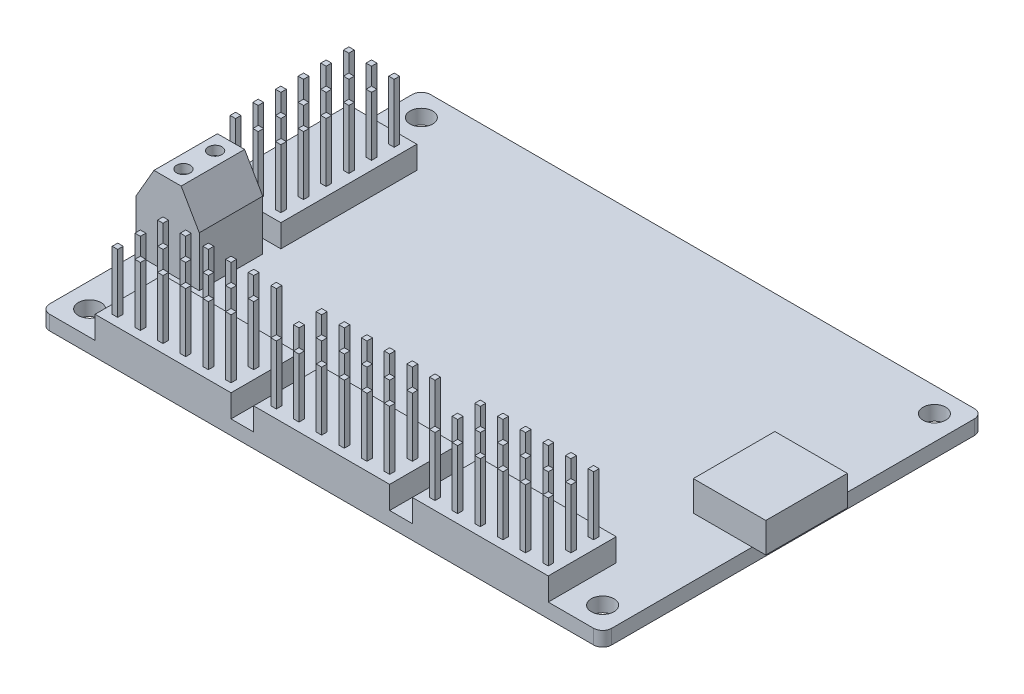
from build123d import *

# Parameters (mm, degrees)
SKETCH1_W                  = 62
SKETCH1_H                  = 42
SKETCH1_R                  = 1.25
BOSS_EXTRUDE1_DEPTH        = 1.6
FILLET1_R                  = 1
SKETCH2_W                  = 8
SKETCH2_H                  = 9
BOSS_EXTRUDE2_DEPTH        = 3.3
SKETCH3_W                  = 15
SKETCH3_H                  = 7.5
BOSS_EXTRUDE3_DEPTH        = 2.5
SKETCH4_W                  = 0.603523816
SKETCH4_H                  = 0.603523816
BOSS_EXTRUDE4_DEPTH        = 6.5
LPATTERN2_COUNT            = 3
LPATTERN2_PITCH            = 2.5
LPATTERN2_COUNT_DIR2       = 6
LPATTERN2_PITCH_DIR2       = 2.5
LPATTERN3_COUNT            = 3
LPATTERN3_PITCH            = 17.5
LPATTERN3_COPY_1_SKETCH_W  = 0.603523816
LPATTERN3_COPY_1_SKETCH_H  = 0.603523816
LPATTERN3_COPY_1_DEPTH     = 6.5
LPATTERN3_COPY_2_SKETCH_W  = 0.603523816
LPATTERN3_COPY_2_SKETCH_H  = 0.603523816
LPATTERN3_COPY_2_DEPTH     = 6.5
LPATTERN3_COPY_3_SKETCH_W  = 0.603523816
LPATTERN3_COPY_3_SKETCH_H  = 0.603523816
LPATTERN3_COPY_3_DEPTH     = 6.5
LPATTERN3_COPY_4_SKETCH_W  = 0.603523816
LPATTERN3_COPY_4_SKETCH_H  = 0.603523816
LPATTERN3_COPY_4_DEPTH     = 6.5
LPATTERN3_COPY_5_SKETCH_W  = 0.603523816
LPATTERN3_COPY_5_SKETCH_H  = 0.603523816
LPATTERN3_COPY_5_DEPTH     = 6.5
LPATTERN3_COPY_6_SKETCH_W  = 0.603523816
LPATTERN3_COPY_6_SKETCH_H  = 0.603523816
LPATTERN3_COPY_6_DEPTH     = 6.5
LPATTERN3_COPY_7_SKETCH_W  = 0.603523816
LPATTERN3_COPY_7_SKETCH_H  = 0.603523816
LPATTERN3_COPY_7_DEPTH     = 6.5
LPATTERN3_COPY_8_SKETCH_W  = 0.603523816
LPATTERN3_COPY_8_SKETCH_H  = 0.603523816
LPATTERN3_COPY_8_DEPTH     = 6.5
LPATTERN3_COPY_9_SKETCH_W  = 0.603523816
LPATTERN3_COPY_9_SKETCH_H  = 0.603523816
LPATTERN3_COPY_9_DEPTH     = 6.5
LPATTERN3_COPY_10_SKETCH_W = 0.603523816
LPATTERN3_COPY_10_SKETCH_H = 0.603523816
LPATTERN3_COPY_10_DEPTH    = 6.5
LPATTERN3_COPY_11_SKETCH_W = 0.603523816
LPATTERN3_COPY_11_SKETCH_H = 0.603523816
LPATTERN3_COPY_11_DEPTH    = 6.5
LPATTERN3_COPY_12_SKETCH_W = 0.603523816
LPATTERN3_COPY_12_SKETCH_H = 0.603523816
LPATTERN3_COPY_12_DEPTH    = 6.5
LPATTERN3_COPY_13_SKETCH_W = 0.603523816
LPATTERN3_COPY_13_SKETCH_H = 0.603523816
LPATTERN3_COPY_13_DEPTH    = 6.5
LPATTERN3_COPY_14_SKETCH_W = 0.603523816
LPATTERN3_COPY_14_SKETCH_H = 0.603523816
LPATTERN3_COPY_14_DEPTH    = 6.5
LPATTERN3_COPY_15_SKETCH_W = 0.603523816
LPATTERN3_COPY_15_SKETCH_H = 0.603523816
LPATTERN3_COPY_15_DEPTH    = 6.5
LPATTERN3_COPY_16_SKETCH_W = 0.603523816
LPATTERN3_COPY_16_SKETCH_H = 0.603523816
LPATTERN3_COPY_16_DEPTH    = 6.5
LPATTERN3_COPY_17_SKETCH_W = 0.603523816
LPATTERN3_COPY_17_SKETCH_H = 0.603523816
LPATTERN3_COPY_17_DEPTH    = 6.5
LPATTERN3_COPY_18_SKETCH_W = 0.603523816
LPATTERN3_COPY_18_SKETCH_H = 0.603523816
LPATTERN3_COPY_18_DEPTH    = 6.5
LPATTERN3_COPY_19_SKETCH_W = 0.603523816
LPATTERN3_COPY_19_SKETCH_H = 0.603523816
LPATTERN3_COPY_19_DEPTH    = 6.5
LPATTERN3_COPY_20_SKETCH_W = 0.603523816
LPATTERN3_COPY_20_SKETCH_H = 0.603523816
LPATTERN3_COPY_20_DEPTH    = 6.5
LPATTERN3_COPY_21_SKETCH_W = 0.603523816
LPATTERN3_COPY_21_SKETCH_H = 0.603523816
LPATTERN3_COPY_21_DEPTH    = 6.5
LPATTERN3_COPY_22_SKETCH_W = 0.603523816
LPATTERN3_COPY_22_SKETCH_H = 0.603523816
LPATTERN3_COPY_22_DEPTH    = 6.5
LPATTERN3_COPY_23_SKETCH_W = 0.603523816
LPATTERN3_COPY_23_SKETCH_H = 0.603523816
LPATTERN3_COPY_23_DEPTH    = 6.5
LPATTERN3_COPY_24_SKETCH_W = 0.603523816
LPATTERN3_COPY_24_SKETCH_H = 0.603523816
LPATTERN3_COPY_24_DEPTH    = 6.5
LPATTERN3_COPY_25_SKETCH_W = 0.603523816
LPATTERN3_COPY_25_SKETCH_H = 0.603523816
LPATTERN3_COPY_25_DEPTH    = 6.5
LPATTERN3_COPY_26_SKETCH_W = 0.603523816
LPATTERN3_COPY_26_SKETCH_H = 0.603523816
LPATTERN3_COPY_26_DEPTH    = 6.5
LPATTERN3_COPY_27_SKETCH_W = 0.603523816
LPATTERN3_COPY_27_SKETCH_H = 0.603523816
LPATTERN3_COPY_27_DEPTH    = 6.5
LPATTERN3_COPY_28_SKETCH_W = 0.603523816
LPATTERN3_COPY_28_SKETCH_H = 0.603523816
LPATTERN3_COPY_28_DEPTH    = 6.5
LPATTERN3_COPY_29_SKETCH_W = 0.603523816
LPATTERN3_COPY_29_SKETCH_H = 0.603523816
LPATTERN3_COPY_29_DEPTH    = 6.5
LPATTERN3_COPY_30_SKETCH_W = 0.603523816
LPATTERN3_COPY_30_SKETCH_H = 0.603523816
LPATTERN3_COPY_30_DEPTH    = 6.5
LPATTERN3_COPY_31_SKETCH_W = 0.603523816
LPATTERN3_COPY_31_SKETCH_H = 0.603523816
LPATTERN3_COPY_31_DEPTH    = 6.5
LPATTERN3_COPY_32_SKETCH_W = 0.603523816
LPATTERN3_COPY_32_SKETCH_H = 0.603523816
LPATTERN3_COPY_32_DEPTH    = 6.5
LPATTERN3_COPY_33_SKETCH_W = 0.603523816
LPATTERN3_COPY_33_SKETCH_H = 0.603523816
LPATTERN3_COPY_33_DEPTH    = 6.5
LPATTERN3_COPY_34_SKETCH_W = 0.603523816
LPATTERN3_COPY_34_SKETCH_H = 0.603523816
LPATTERN3_COPY_34_DEPTH    = 6.5
SKETCH5_W                  = 7.5
SKETCH5_H                  = 15
BOSS_EXTRUDE5_DEPTH        = 2.5
SKETCH6_W                  = 7
SKETCH6_H                  = 7
BOSS_EXTRUDE6_DEPTH        = 9
CHAMFER1_SIZE              = 2
CHAMFER1_SIZE2             = 3.464101615
SKETCH8_W                  = 0.6
SKETCH8_H                  = 0.6
BOSS_EXTRUDE7_DEPTH        = 6.5
SKETCH7_R                  = 0.75
CUT_EXTRUDE1_DEPTH         = 1
LPATTERN4_COUNT            = 3
LPATTERN4_PITCH            = 2.5
LPATTERN4_COUNT_DIR2       = 6
LPATTERN4_PITCH_DIR2       = 2.5


with BuildPart() as part:
    # Sketch1 → Boss-Extrude1 (new body)
    with BuildSketch(Plane(origin=(0, 0, 0), x_dir=(1, 0, 0), z_dir=(0, 1, 0))):
        Rectangle(SKETCH1_W, SKETCH1_H)
        with Locations(Location((-28.3, 18.3, 0), (0, 0, 270))):
            Circle(SKETCH1_R, mode=Mode.SUBTRACT)
        with Locations(Location((28.3, 18.3, 0), (0, 0, 270))):
            Circle(SKETCH1_R, mode=Mode.SUBTRACT)
        with Locations(Location((28.3, -18.3, 0), (0, 0, 270))):
            Circle(SKETCH1_R, mode=Mode.SUBTRACT)
        with Locations(Location((-28.3, -18.3, 0), (0, 0, 270))):
            Circle(SKETCH1_R, mode=Mode.SUBTRACT)
    extrude(amount=BOSS_EXTRUDE1_DEPTH)

    # Fillet1
    fillet1_edges = [part.edges().sort_by_distance(p)[0] for p in [
        (31, 0.8, 21),
        (-31, 0.8, 21),
        (-31, 0.8, -21),
        (31, 0.8, -21),
    ]]
    fillet(fillet1_edges, radius=FILLET1_R)

    # Sketch2 → Boss-Extrude2 (add)
    with BuildSketch(Plane(origin=(0, 1.6, 0), x_dir=(1, 0, 0), z_dir=(0, 1, 0))):
        with Locations((28.5, 0)):
            Rectangle(SKETCH2_W, SKETCH2_H)
    extrude(amount=BOSS_EXTRUDE2_DEPTH)

    # Sketch3 → Boss-Extrude3 (add)
    with BuildSketch(Plane(origin=(0, 1.6, 0), x_dir=(1, 0, 0), z_dir=(0, 1, 0))):
        with Locations((17.5, -17.25)):
            Rectangle(SKETCH3_W, SKETCH3_H)
    boss_extrude3 = extrude(amount=BOSS_EXTRUDE3_DEPTH)

    # Sketch4 → Boss-Extrude4 (add)
    with BuildSketch(Plane(origin=(0, 4.1, 0), x_dir=(1, 0, 0), z_dir=(0, 1, 0))):
        with Locations((23.75, -19.75)):
            Rectangle(SKETCH4_W, SKETCH4_H)
    boss_extrude4 = extrude(amount=BOSS_EXTRUDE4_DEPTH)

    # LPattern2: Boss-Extrude4 3 × 6
    with Locations(*[(-j * LPATTERN2_PITCH_DIR2, 0, -i * LPATTERN2_PITCH) for i in range(LPATTERN2_COUNT) for j in range(LPATTERN2_COUNT_DIR2) if (i, j) != (0, 0)]):
        add(boss_extrude4)

    # LPattern3: Boss-Extrude3, Boss-Extrude4 ×3
    with Locations(*[(-i * LPATTERN3_PITCH, 0, 0) for i in range(1, LPATTERN3_COUNT)]):
        add(boss_extrude3)
        add(boss_extrude4)

    # LPattern3 copy 1 sketch → LPattern3 copy 1 (add)
    with BuildSketch(Plane(origin=(-20, 4.1, 0), x_dir=(1, 0, 0), z_dir=(0, 1, 0))):
        with Locations((23.75, -19.75)):
            Rectangle(LPATTERN3_COPY_1_SKETCH_W, LPATTERN3_COPY_1_SKETCH_H)
    extrude(amount=LPATTERN3_COPY_1_DEPTH)

    # LPattern3 copy 2 sketch → LPattern3 copy 2 (add)
    with BuildSketch(Plane(origin=(-37.5, 4.1, 0), x_dir=(1, 0, 0), z_dir=(0, 1, 0))):
        with Locations((23.75, -19.75)):
            Rectangle(LPATTERN3_COPY_2_SKETCH_W, LPATTERN3_COPY_2_SKETCH_H)
    extrude(amount=LPATTERN3_COPY_2_DEPTH)

    # LPattern3 copy 3 sketch → LPattern3 copy 3 (add)
    with BuildSketch(Plane(origin=(-22.5, 4.1, 0), x_dir=(1, 0, 0), z_dir=(0, 1, 0))):
        with Locations((23.75, -19.75)):
            Rectangle(LPATTERN3_COPY_3_SKETCH_W, LPATTERN3_COPY_3_SKETCH_H)
    extrude(amount=LPATTERN3_COPY_3_DEPTH)

    # LPattern3 copy 4 sketch → LPattern3 copy 4 (add)
    with BuildSketch(Plane(origin=(-40, 4.1, 0), x_dir=(1, 0, 0), z_dir=(0, 1, 0))):
        with Locations((23.75, -19.75)):
            Rectangle(LPATTERN3_COPY_4_SKETCH_W, LPATTERN3_COPY_4_SKETCH_H)
    extrude(amount=LPATTERN3_COPY_4_DEPTH)

    # LPattern3 copy 5 sketch → LPattern3 copy 5 (add)
    with BuildSketch(Plane(origin=(-25, 4.1, 0), x_dir=(1, 0, 0), z_dir=(0, 1, 0))):
        with Locations((23.75, -19.75)):
            Rectangle(LPATTERN3_COPY_5_SKETCH_W, LPATTERN3_COPY_5_SKETCH_H)
    extrude(amount=LPATTERN3_COPY_5_DEPTH)

    # LPattern3 copy 6 sketch → LPattern3 copy 6 (add)
    with BuildSketch(Plane(origin=(-42.5, 4.1, 0), x_dir=(1, 0, 0), z_dir=(0, 1, 0))):
        with Locations((23.75, -19.75)):
            Rectangle(LPATTERN3_COPY_6_SKETCH_W, LPATTERN3_COPY_6_SKETCH_H)
    extrude(amount=LPATTERN3_COPY_6_DEPTH)

    # LPattern3 copy 7 sketch → LPattern3 copy 7 (add)
    with BuildSketch(Plane(origin=(-27.5, 4.1, 0), x_dir=(1, 0, 0), z_dir=(0, 1, 0))):
        with Locations((23.75, -19.75)):
            Rectangle(LPATTERN3_COPY_7_SKETCH_W, LPATTERN3_COPY_7_SKETCH_H)
    extrude(amount=LPATTERN3_COPY_7_DEPTH)

    # LPattern3 copy 8 sketch → LPattern3 copy 8 (add)
    with BuildSketch(Plane(origin=(-45, 4.1, 0), x_dir=(1, 0, 0), z_dir=(0, 1, 0))):
        with Locations((23.75, -19.75)):
            Rectangle(LPATTERN3_COPY_8_SKETCH_W, LPATTERN3_COPY_8_SKETCH_H)
    extrude(amount=LPATTERN3_COPY_8_DEPTH)

    # LPattern3 copy 9 sketch → LPattern3 copy 9 (add)
    with BuildSketch(Plane(origin=(-30, 4.1, 0), x_dir=(1, 0, 0), z_dir=(0, 1, 0))):
        with Locations((23.75, -19.75)):
            Rectangle(LPATTERN3_COPY_9_SKETCH_W, LPATTERN3_COPY_9_SKETCH_H)
    extrude(amount=LPATTERN3_COPY_9_DEPTH)

    # LPattern3 copy 10 sketch → LPattern3 copy 10 (add)
    with BuildSketch(Plane(origin=(-47.5, 4.1, 0), x_dir=(1, 0, 0), z_dir=(0, 1, 0))):
        with Locations((23.75, -19.75)):
            Rectangle(LPATTERN3_COPY_10_SKETCH_W, LPATTERN3_COPY_10_SKETCH_H)
    extrude(amount=LPATTERN3_COPY_10_DEPTH)

    # LPattern3 copy 11 sketch → LPattern3 copy 11 (add)
    with BuildSketch(Plane(origin=(-17.5, 4.1, -2.5), x_dir=(1, 0, 0), z_dir=(0, 1, 0))):
        with Locations((23.75, -19.75)):
            Rectangle(LPATTERN3_COPY_11_SKETCH_W, LPATTERN3_COPY_11_SKETCH_H)
    extrude(amount=LPATTERN3_COPY_11_DEPTH)

    # LPattern3 copy 12 sketch → LPattern3 copy 12 (add)
    with BuildSketch(Plane(origin=(-35, 4.1, -2.5), x_dir=(1, 0, 0), z_dir=(0, 1, 0))):
        with Locations((23.75, -19.75)):
            Rectangle(LPATTERN3_COPY_12_SKETCH_W, LPATTERN3_COPY_12_SKETCH_H)
    extrude(amount=LPATTERN3_COPY_12_DEPTH)

    # LPattern3 copy 13 sketch → LPattern3 copy 13 (add)
    with BuildSketch(Plane(origin=(-20, 4.1, -2.5), x_dir=(1, 0, 0), z_dir=(0, 1, 0))):
        with Locations((23.75, -19.75)):
            Rectangle(LPATTERN3_COPY_13_SKETCH_W, LPATTERN3_COPY_13_SKETCH_H)
    extrude(amount=LPATTERN3_COPY_13_DEPTH)

    # LPattern3 copy 14 sketch → LPattern3 copy 14 (add)
    with BuildSketch(Plane(origin=(-37.5, 4.1, -2.5), x_dir=(1, 0, 0), z_dir=(0, 1, 0))):
        with Locations((23.75, -19.75)):
            Rectangle(LPATTERN3_COPY_14_SKETCH_W, LPATTERN3_COPY_14_SKETCH_H)
    extrude(amount=LPATTERN3_COPY_14_DEPTH)

    # LPattern3 copy 15 sketch → LPattern3 copy 15 (add)
    with BuildSketch(Plane(origin=(-22.5, 4.1, -2.5), x_dir=(1, 0, 0), z_dir=(0, 1, 0))):
        with Locations((23.75, -19.75)):
            Rectangle(LPATTERN3_COPY_15_SKETCH_W, LPATTERN3_COPY_15_SKETCH_H)
    extrude(amount=LPATTERN3_COPY_15_DEPTH)

    # LPattern3 copy 16 sketch → LPattern3 copy 16 (add)
    with BuildSketch(Plane(origin=(-40, 4.1, -2.5), x_dir=(1, 0, 0), z_dir=(0, 1, 0))):
        with Locations((23.75, -19.75)):
            Rectangle(LPATTERN3_COPY_16_SKETCH_W, LPATTERN3_COPY_16_SKETCH_H)
    extrude(amount=LPATTERN3_COPY_16_DEPTH)

    # LPattern3 copy 17 sketch → LPattern3 copy 17 (add)
    with BuildSketch(Plane(origin=(-25, 4.1, -2.5), x_dir=(1, 0, 0), z_dir=(0, 1, 0))):
        with Locations((23.75, -19.75)):
            Rectangle(LPATTERN3_COPY_17_SKETCH_W, LPATTERN3_COPY_17_SKETCH_H)
    extrude(amount=LPATTERN3_COPY_17_DEPTH)

    # LPattern3 copy 18 sketch → LPattern3 copy 18 (add)
    with BuildSketch(Plane(origin=(-42.5, 4.1, -2.5), x_dir=(1, 0, 0), z_dir=(0, 1, 0))):
        with Locations((23.75, -19.75)):
            Rectangle(LPATTERN3_COPY_18_SKETCH_W, LPATTERN3_COPY_18_SKETCH_H)
    extrude(amount=LPATTERN3_COPY_18_DEPTH)

    # LPattern3 copy 19 sketch → LPattern3 copy 19 (add)
    with BuildSketch(Plane(origin=(-27.5, 4.1, -2.5), x_dir=(1, 0, 0), z_dir=(0, 1, 0))):
        with Locations((23.75, -19.75)):
            Rectangle(LPATTERN3_COPY_19_SKETCH_W, LPATTERN3_COPY_19_SKETCH_H)
    extrude(amount=LPATTERN3_COPY_19_DEPTH)

    # LPattern3 copy 20 sketch → LPattern3 copy 20 (add)
    with BuildSketch(Plane(origin=(-45, 4.1, -2.5), x_dir=(1, 0, 0), z_dir=(0, 1, 0))):
        with Locations((23.75, -19.75)):
            Rectangle(LPATTERN3_COPY_20_SKETCH_W, LPATTERN3_COPY_20_SKETCH_H)
    extrude(amount=LPATTERN3_COPY_20_DEPTH)

    # LPattern3 copy 21 sketch → LPattern3 copy 21 (add)
    with BuildSketch(Plane(origin=(-30, 4.1, -2.5), x_dir=(1, 0, 0), z_dir=(0, 1, 0))):
        with Locations((23.75, -19.75)):
            Rectangle(LPATTERN3_COPY_21_SKETCH_W, LPATTERN3_COPY_21_SKETCH_H)
    extrude(amount=LPATTERN3_COPY_21_DEPTH)

    # LPattern3 copy 22 sketch → LPattern3 copy 22 (add)
    with BuildSketch(Plane(origin=(-47.5, 4.1, -2.5), x_dir=(1, 0, 0), z_dir=(0, 1, 0))):
        with Locations((23.75, -19.75)):
            Rectangle(LPATTERN3_COPY_22_SKETCH_W, LPATTERN3_COPY_22_SKETCH_H)
    extrude(amount=LPATTERN3_COPY_22_DEPTH)

    # LPattern3 copy 23 sketch → LPattern3 copy 23 (add)
    with BuildSketch(Plane(origin=(-17.5, 4.1, -5), x_dir=(1, 0, 0), z_dir=(0, 1, 0))):
        with Locations((23.75, -19.75)):
            Rectangle(LPATTERN3_COPY_23_SKETCH_W, LPATTERN3_COPY_23_SKETCH_H)
    extrude(amount=LPATTERN3_COPY_23_DEPTH)

    # LPattern3 copy 24 sketch → LPattern3 copy 24 (add)
    with BuildSketch(Plane(origin=(-35, 4.1, -5), x_dir=(1, 0, 0), z_dir=(0, 1, 0))):
        with Locations((23.75, -19.75)):
            Rectangle(LPATTERN3_COPY_24_SKETCH_W, LPATTERN3_COPY_24_SKETCH_H)
    extrude(amount=LPATTERN3_COPY_24_DEPTH)

    # LPattern3 copy 25 sketch → LPattern3 copy 25 (add)
    with BuildSketch(Plane(origin=(-20, 4.1, -5), x_dir=(1, 0, 0), z_dir=(0, 1, 0))):
        with Locations((23.75, -19.75)):
            Rectangle(LPATTERN3_COPY_25_SKETCH_W, LPATTERN3_COPY_25_SKETCH_H)
    extrude(amount=LPATTERN3_COPY_25_DEPTH)

    # LPattern3 copy 26 sketch → LPattern3 copy 26 (add)
    with BuildSketch(Plane(origin=(-37.5, 4.1, -5), x_dir=(1, 0, 0), z_dir=(0, 1, 0))):
        with Locations((23.75, -19.75)):
            Rectangle(LPATTERN3_COPY_26_SKETCH_W, LPATTERN3_COPY_26_SKETCH_H)
    extrude(amount=LPATTERN3_COPY_26_DEPTH)

    # LPattern3 copy 27 sketch → LPattern3 copy 27 (add)
    with BuildSketch(Plane(origin=(-22.5, 4.1, -5), x_dir=(1, 0, 0), z_dir=(0, 1, 0))):
        with Locations((23.75, -19.75)):
            Rectangle(LPATTERN3_COPY_27_SKETCH_W, LPATTERN3_COPY_27_SKETCH_H)
    extrude(amount=LPATTERN3_COPY_27_DEPTH)

    # LPattern3 copy 28 sketch → LPattern3 copy 28 (add)
    with BuildSketch(Plane(origin=(-40, 4.1, -5), x_dir=(1, 0, 0), z_dir=(0, 1, 0))):
        with Locations((23.75, -19.75)):
            Rectangle(LPATTERN3_COPY_28_SKETCH_W, LPATTERN3_COPY_28_SKETCH_H)
    extrude(amount=LPATTERN3_COPY_28_DEPTH)

    # LPattern3 copy 29 sketch → LPattern3 copy 29 (add)
    with BuildSketch(Plane(origin=(-25, 4.1, -5), x_dir=(1, 0, 0), z_dir=(0, 1, 0))):
        with Locations((23.75, -19.75)):
            Rectangle(LPATTERN3_COPY_29_SKETCH_W, LPATTERN3_COPY_29_SKETCH_H)
    extrude(amount=LPATTERN3_COPY_29_DEPTH)

    # LPattern3 copy 30 sketch → LPattern3 copy 30 (add)
    with BuildSketch(Plane(origin=(-42.5, 4.1, -5), x_dir=(1, 0, 0), z_dir=(0, 1, 0))):
        with Locations((23.75, -19.75)):
            Rectangle(LPATTERN3_COPY_30_SKETCH_W, LPATTERN3_COPY_30_SKETCH_H)
    extrude(amount=LPATTERN3_COPY_30_DEPTH)

    # LPattern3 copy 31 sketch → LPattern3 copy 31 (add)
    with BuildSketch(Plane(origin=(-27.5, 4.1, -5), x_dir=(1, 0, 0), z_dir=(0, 1, 0))):
        with Locations((23.75, -19.75)):
            Rectangle(LPATTERN3_COPY_31_SKETCH_W, LPATTERN3_COPY_31_SKETCH_H)
    extrude(amount=LPATTERN3_COPY_31_DEPTH)

    # LPattern3 copy 32 sketch → LPattern3 copy 32 (add)
    with BuildSketch(Plane(origin=(-45, 4.1, -5), x_dir=(1, 0, 0), z_dir=(0, 1, 0))):
        with Locations((23.75, -19.75)):
            Rectangle(LPATTERN3_COPY_32_SKETCH_W, LPATTERN3_COPY_32_SKETCH_H)
    extrude(amount=LPATTERN3_COPY_32_DEPTH)

    # LPattern3 copy 33 sketch → LPattern3 copy 33 (add)
    with BuildSketch(Plane(origin=(-30, 4.1, -5), x_dir=(1, 0, 0), z_dir=(0, 1, 0))):
        with Locations((23.75, -19.75)):
            Rectangle(LPATTERN3_COPY_33_SKETCH_W, LPATTERN3_COPY_33_SKETCH_H)
    extrude(amount=LPATTERN3_COPY_33_DEPTH)

    # LPattern3 copy 34 sketch → LPattern3 copy 34 (add)
    with BuildSketch(Plane(origin=(-47.5, 4.1, -5), x_dir=(1, 0, 0), z_dir=(0, 1, 0))):
        with Locations((23.75, -19.75)):
            Rectangle(LPATTERN3_COPY_34_SKETCH_W, LPATTERN3_COPY_34_SKETCH_H)
    extrude(amount=LPATTERN3_COPY_34_DEPTH)

    # Sketch5 → Boss-Extrude5 (add)
    with BuildSketch(Plane(origin=(0, 1.6, 0), x_dir=(1, 0, 0), z_dir=(0, 1, 0))):
        with Locations((-27.25, 5.5)):
            Rectangle(SKETCH5_W, SKETCH5_H)
    extrude(amount=BOSS_EXTRUDE5_DEPTH)

    # Sketch6 → Boss-Extrude6 (add)
    with BuildSketch(Plane(origin=(0, 1.6, 0), x_dir=(1, 0, 0), z_dir=(0, 1, 0))):
        with Locations((-27.5, -7)):
            Rectangle(SKETCH6_W, SKETCH6_H)
    extrude(amount=BOSS_EXTRUDE6_DEPTH)

    # Chamfer1
    chamfer1_edges = [part.edges().sort_by_distance(p)[0] for p in [
        (-31, 10.6, 7),
        (-24, 10.6, 7),
    ]]
    chamfer1_side = [part.faces().sort_by_distance(p)[0] for p in [
        (-27.5, 10.6, 7),
    ]]
    chamfer(chamfer1_edges, length=CHAMFER1_SIZE, length2=CHAMFER1_SIZE2, reference=chamfer1_side[0])

    # Sketch8 → Boss-Extrude7 (add)
    with BuildSketch(Plane(origin=(0, 4.1, 0), x_dir=(1, 0, 0), z_dir=(0, 1, 0))):
        with Locations((-29.75, -0.75)):
            Rectangle(SKETCH8_W, SKETCH8_H)
    boss_extrude7 = extrude(amount=BOSS_EXTRUDE7_DEPTH)

    # Sketch7 → Cut-Extrude1 (cut)
    with BuildSketch(Plane(origin=(0, 10.6, 0), x_dir=(1, 0, 0), z_dir=(0, 1, 0))):
        with Locations(Location((-27.5, -8.75, 0), (0, 0, 270))):
            Circle(SKETCH7_R)
        with Locations(Location((-27.5, -5.25, 0), (0, 0, 270))):
            Circle(SKETCH7_R)
    extrude(amount=-CUT_EXTRUDE1_DEPTH, mode=Mode.SUBTRACT)

    # LPattern4: Boss-Extrude7 3 × 6
    with Locations(*[(i * LPATTERN4_PITCH, 0, -j * LPATTERN4_PITCH_DIR2) for i in range(LPATTERN4_COUNT) for j in range(LPATTERN4_COUNT_DIR2) if (i, j) != (0, 0)]):
        add(boss_extrude7)


solid = part.part
